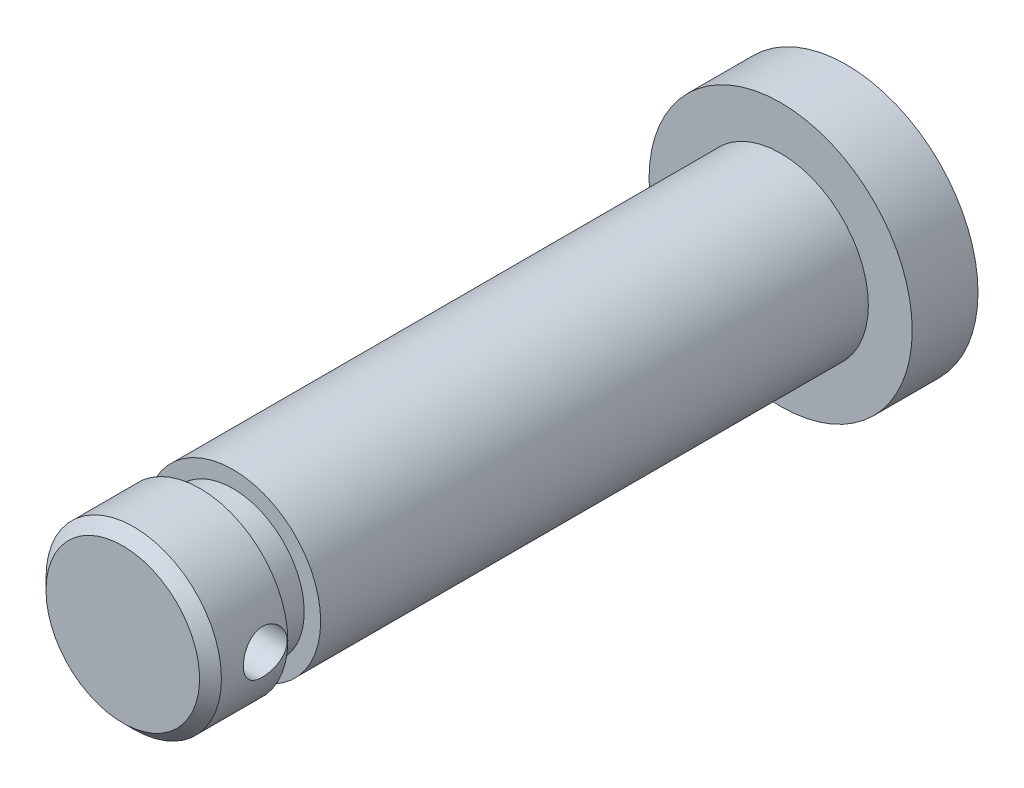
from build123d import *

# Parameters (mm, degrees)
SKETCH_9_R           = 2
CUT_EXTRUDE_12_DEPTH = 20
SKETCH_13_W          = 2
SKETCH_13_H          = 3


with BuildPart() as part:
    # 草图8 → 旋转2 (revolve)
    with BuildSketch(Plane(origin=(0, 0, 0), x_dir=(1, 0, 0), z_dir=(0, 1, 0)), mode=Mode.PRIVATE) as revolve_2_sk:
        Polygon((0, 0), (12, 0), (12, -6), (8, -6), (8, -65), (7, -66), (0, -66), align=None)
    revolve(revolve_2_sk.sketch.rotate(Axis((0, 0, 0), (0, 0, 1)), 180), axis=Axis((0, 0, 0), (0, 0, 1)))

    # 草图9 → 切除-拉伸12 (cut)
    with BuildSketch(Plane(origin=(9, 0, 0), x_dir=(0, 0, -1), z_dir=(1, 0, 0))):
        with Locations((-61, 0)):
            Circle(SKETCH_9_R)
    extrude(amount=-CUT_EXTRUDE_12_DEPTH, mode=Mode.SUBTRACT)

    # 草图13 → 切除-旋转3 (revolve, cut)
    with BuildSketch(Plane(origin=(0, 0, 0), x_dir=(1, 0, 0), z_dir=(0, 1, 0)), mode=Mode.PRIVATE) as cut_revolve_3_sk:
        with Locations((7.5, -57.45)):
            Rectangle(SKETCH_13_W, SKETCH_13_H)
    revolve(cut_revolve_3_sk.sketch.rotate(Axis((0, 0, 0), (0, 0, 1)), 180), axis=Axis((0, 0, 0), (0, 0, 1)), mode=Mode.SUBTRACT)


solid = part.part
